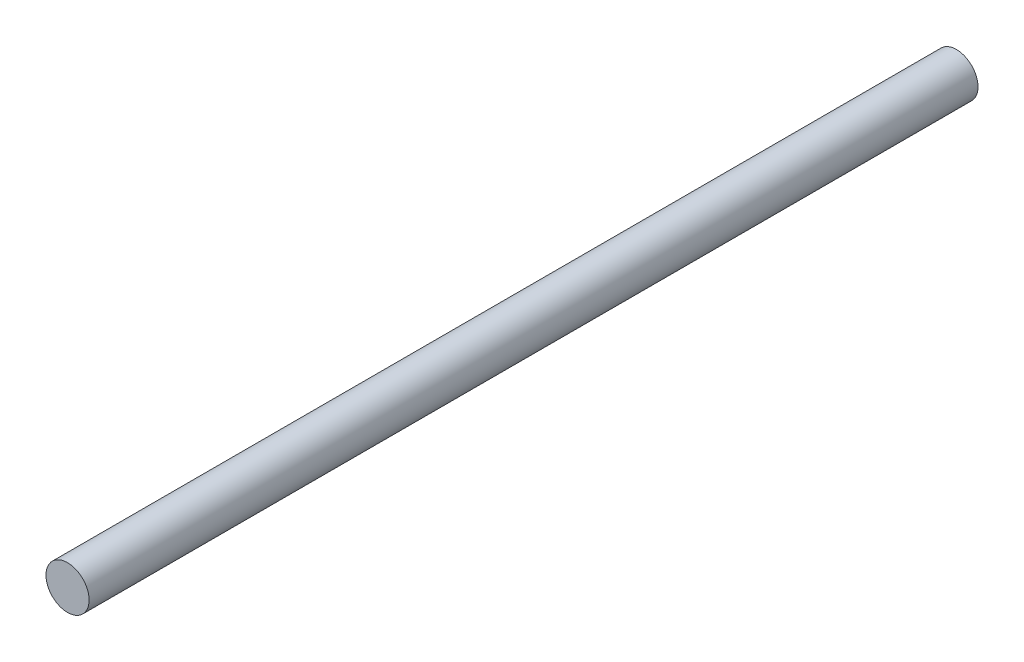
from build123d import *

# Parameters (mm, degrees)
BODY_SKETCH_R = 2.5
BODY_DEPTH    = 103


with BuildPart() as part:
    # Body sketch → Body (new body)
    with BuildSketch(Plane.XY):
        Circle(BODY_SKETCH_R)
    extrude(amount=BODY_DEPTH)


solid = part.part
